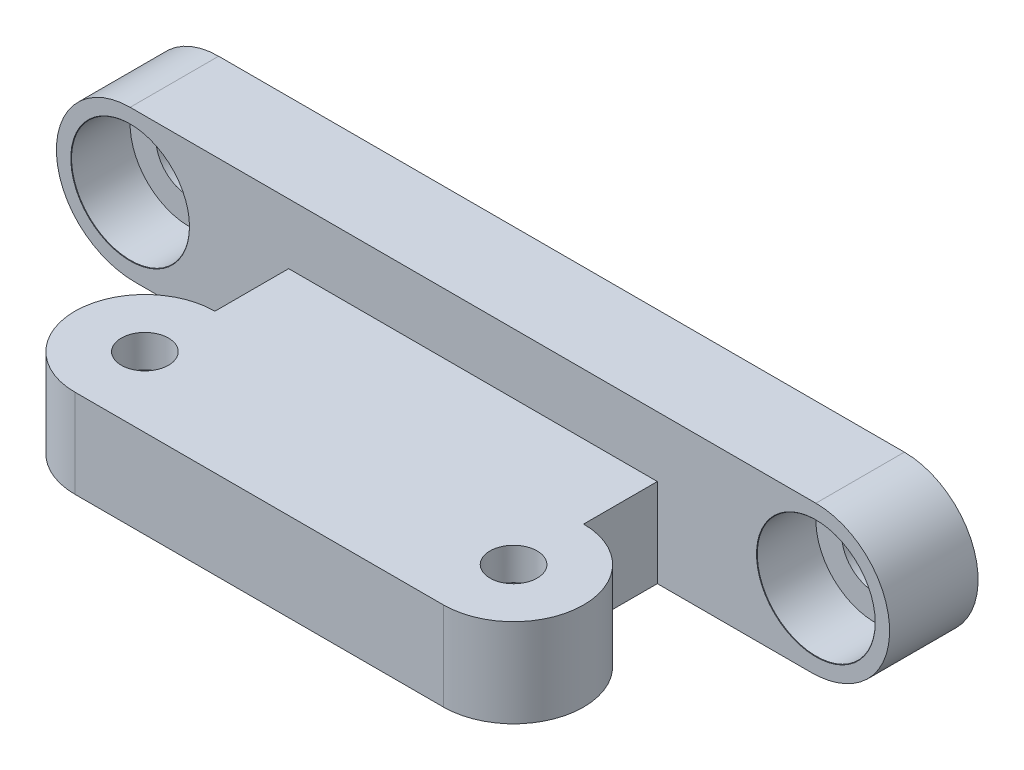
from build123d import *

# Parameters (mm, degrees)
BOSS_EXTRUDE1_DEPTH           = 6
M3_CLEARANCE_HOLE1_D          = 3.2
SKETCH7_R                     = 2.75
CUT_EXTRUDE1_DEPTH            = 3.8
CUT_EXTRUDE1_DRAFT            = 3
CUT_EXTRUDE1_PROFILE_2_DEPTH  = 3.8
CUT_EXTRUDE1_PROFILE_2_DRAFT  = 3
BOSS_EXTRUDE2_DEPTH           = 6
CBORE_FOR_M4_SHCS1_AT_2_COUNT = 2
CBORE_FOR_M4_SHCS1_AT_2_PITCH = 46.5


with BuildPart() as part:
    # Sketch1 → Boss-Extrude1 (new body)
    with BuildSketch(Plane(origin=(0, 0, 0), x_dir=(1, 0, 0), z_dir=(0, 1, 0))):
        with BuildLine():
            Line((-12.5, -4.75), (12.5, -4.75))
            ThreePointArc((12.5, -4.75), (17.25, 0), (12.5, 4.75))
            Line((12.5, 4.75), (12.5, 9.75))
            Line((12.5, 9.75), (-12.5, 9.75))
            Line((-12.5, 9.75), (-12.5, 4.75))
            ThreePointArc((-12.5, 4.75), (-17.25, 0), (-12.5, -4.75))
        make_face()
    extrude(amount=-BOSS_EXTRUDE1_DEPTH)

    # M3 Clearance Hole1 (through all)
    with Locations(Plane(origin=(0, -6, 0), x_dir=(-1, 0, 0), z_dir=(0, -1, 0))):
        with Locations((12.5, 0), (-12.5, 0)):
            Hole(M3_CLEARANCE_HOLE1_D / 2)


with BuildPart() as cut_extrude1_tool:
    # Sketch7 → Cut-Extrude1 (with draft: the straight prism first)
    with BuildSketch(Plane(origin=(0, -6, 0), x_dir=(-1, 0, 0), z_dir=(0, 1, 0))):
        with Locations((12.5, 0)):
            Circle(SKETCH7_R)
    extrude(amount=CUT_EXTRUDE1_DEPTH)
    # Cut-Extrude1: the draft: its side faces are tilted about the plane it starts from
    cut_extrude1_sides = [cut_extrude1_tool.faces().sort_by_distance(p)[0] for p in [
        (-9.75, -4.1, 0),
    ]]
    draft(cut_extrude1_sides, Plane(origin=(0, -6, 0), x_dir=(-1, 0, 0), z_dir=(0, 1, 0)), CUT_EXTRUDE1_DRAFT)


with BuildPart() as part_1:
    add(part.part)

    # Cut-Extrude1: cut by cut_extrude1_tool
    add(cut_extrude1_tool.part, mode=Mode.SUBTRACT)


with BuildPart() as cut_extrude1_profile_2_tool:
    # Sketch7 → Cut-Extrude1 profile 2 (with draft: the straight prism first)
    with BuildSketch(Plane(origin=(0, -6, 0), x_dir=(-1, 0, 0), z_dir=(0, 1, 0))):
        with Locations((-12.5, 0)):
            Circle(SKETCH7_R)
    extrude(amount=CUT_EXTRUDE1_PROFILE_2_DEPTH)
    # Cut-Extrude1 profile 2: the draft: its side faces are tilted about the plane it starts from
    cut_extrude1_profile_2_sides = [cut_extrude1_profile_2_tool.faces().sort_by_distance(p)[0] for p in [
        (15.25, -4.1, 0),
    ]]
    draft(cut_extrude1_profile_2_sides, Plane(origin=(0, -6, 0), x_dir=(-1, 0, 0), z_dir=(0, 1, 0)), CUT_EXTRUDE1_PROFILE_2_DRAFT)


with BuildPart() as part_2:
    add(part_1.part)

    # Cut-Extrude1 profile 2: cut by cut_extrude1_profile_2_tool
    add(cut_extrude1_profile_2_tool.part, mode=Mode.SUBTRACT)

    # Sketch4 → Boss-Extrude2 (add)
    with BuildSketch(Plane(origin=(0, 0, -9.75), x_dir=(-1, 0, 0), z_dir=(0, 0, -1))):
        with BuildLine():
            Line((23.25, 4.1), (-23.25, 4.1))
            ThreePointArc((-23.25, 4.1), (-27.99341649, 0.68113883), (-26.25, -4.9))
            ThreePointArc((-26.25, -4.9), (-24.689252713, -5.717758139), (-22.95, -6))
            Line((-22.95, -6), (22.95, -6))
            ThreePointArc((22.95, -6), (24.689252713, -5.717758139), (26.25, -4.9))
            ThreePointArc((26.25, -4.9), (27.99341649, 0.68113883), (23.25, 4.1))
        make_face()
    extrude(amount=BOSS_EXTRUDE2_DEPTH)

    # Sketch9 → CBORE for M4 SHCS1 (revolve, cut)
    with BuildSketch(Plane(origin=(23.25, -0.9, -9.75), x_dir=(0, -1, 0), z_dir=(1, 0, 0))):
        Polygon((0, 0), (0, 11.351936393), (2.25, 10), (2.25, 4), (4, 4), (4, 0.025), (4.025, 0), align=None)
    cbore_for_m4_shcs1 = revolve(axis=Axis((23.25, -0.9, -3.4), (0, 0, -1)), mode=Mode.SUBTRACT)

    # CBORE for M4 SHCS1 at 2: CBORE for M4 SHCS1 ×2
    with Locations(*[(-i * CBORE_FOR_M4_SHCS1_AT_2_PITCH, 0, 0) for i in range(1, CBORE_FOR_M4_SHCS1_AT_2_COUNT)]):
        add(cbore_for_m4_shcs1, mode=Mode.SUBTRACT)


solid = part_2.part
